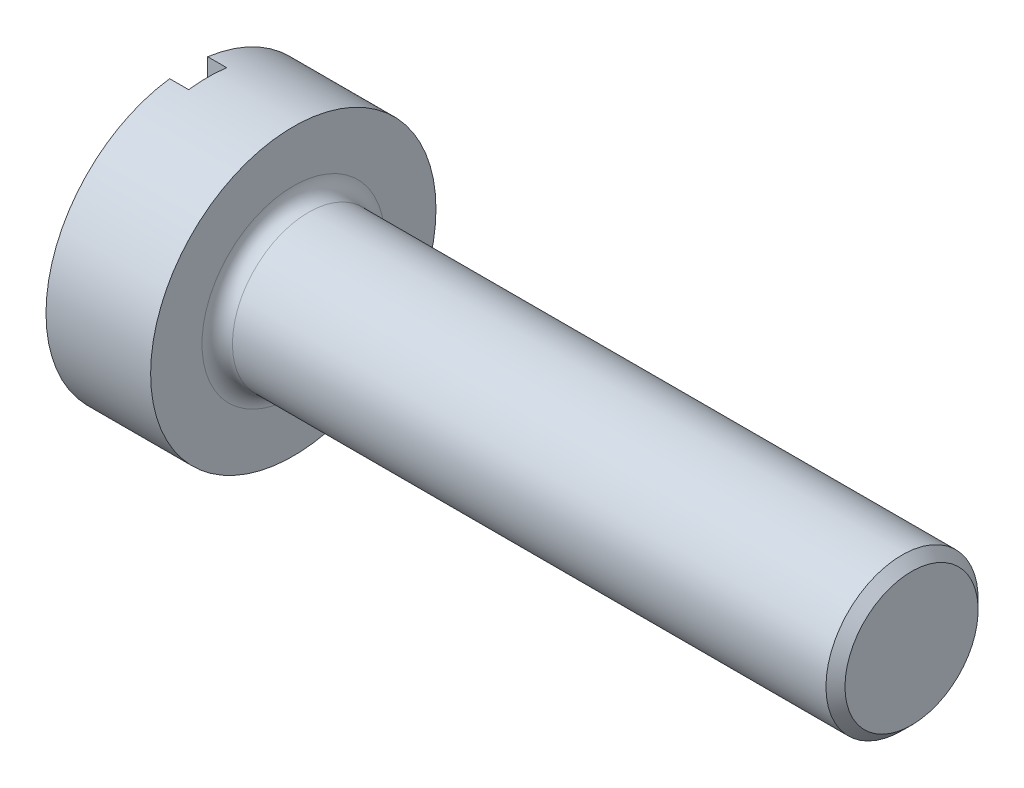
from build123d import *

# Parameters (mm, degrees)
SKETCH1_W           = 6.5
SKETCH1_H           = 0.8
CHAMFER1_SIZE       = 0.1
FILLET1_R           = 0.16
EXTRUDE1_DEPTH      = 8.890500618
EXTRUDE1_DEPTH_BACK = 8.890500618
SKETCH2_W           = 0.2
SKETCH2_H           = 0.2


with BuildPart() as part:
    # Sketch1 → Revolve1 (revolve)
    with BuildSketch(Plane.XY, mode=Mode.PRIVATE) as revolve1_sk:
        Polygon((0, 1.5), (0, 0), (1.1, 0), (1.1, 0.8), (1.1, 1.5), align=None)
        with Locations((4.35, 0.4)):
            Rectangle(SKETCH1_W, SKETCH1_H)
    revolve(revolve1_sk.sketch.rotate(Axis((0, 0, 0), (1, 0, 0)), 90), axis=Axis((0, 0, 0), (1, 0, 0)))

    # Chamfer1
    chamfer1_edges = [part.edges().sort_by_distance(p)[0] for p in [
        (7.6, 0, -0.8),
    ]]
    chamfer(chamfer1_edges, length=CHAMFER1_SIZE)

    # Fillet1
    fillet1_edges = [part.edges().sort_by_distance(p)[0] for p in [
        (1.1, 0, -0.8),
    ]]
    fillet(fillet1_edges, radius=FILLET1_R)

    # Sketch2 → Extrude1 (cut, two sides: drawn at the far end of the back side and taken through both)
    with BuildSketch(Plane(origin=(0, 0, 0), x_dir=(1, 0, 0), z_dir=(0, 1, 0)).offset(-EXTRUDE1_DEPTH_BACK)):
        with Locations((0.1, -0.1)):
            Rectangle(SKETCH2_W, SKETCH2_H)
        with Locations((0.1, 0.1)):
            Rectangle(SKETCH2_W, SKETCH2_H)
    extrude(amount=EXTRUDE1_DEPTH + EXTRUDE1_DEPTH_BACK, mode=Mode.SUBTRACT)


solid = part.part
